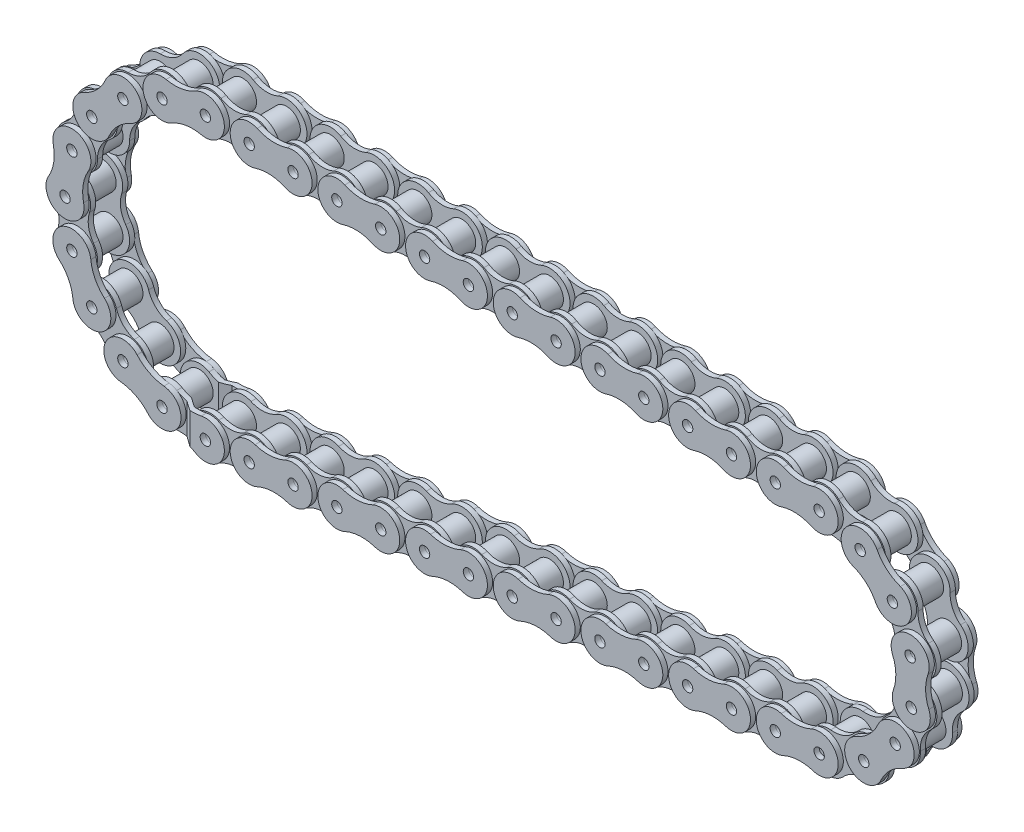
from build123d import *

# Parameters (mm, degrees)
SKETCH4_R              = 4
BOSS_EXTRUDE1_DEPTH    = 3.9
BOSS_EXTRUDE1_2_DEPTH  = 3.9
BOSS_EXTRUDE1_3_DEPTH  = 3.9
BOSS_EXTRUDE1_4_DEPTH  = 3.9
BOSS_EXTRUDE1_5_DEPTH  = 3.9
BOSS_EXTRUDE1_6_DEPTH  = 3.9
BOSS_EXTRUDE1_7_DEPTH  = 3.9
BOSS_EXTRUDE1_8_DEPTH  = 3.9
BOSS_EXTRUDE1_9_DEPTH  = 3.9
BOSS_EXTRUDE1_10_DEPTH = 3.9
BOSS_EXTRUDE1_11_DEPTH = 3.9
BOSS_EXTRUDE1_12_DEPTH = 3.9
BOSS_EXTRUDE1_13_DEPTH = 3.9
BOSS_EXTRUDE1_14_DEPTH = 3.9
BOSS_EXTRUDE1_15_DEPTH = 3.9
BOSS_EXTRUDE1_16_DEPTH = 3.9
BOSS_EXTRUDE1_17_DEPTH = 3.9
BOSS_EXTRUDE1_18_DEPTH = 3.9
BOSS_EXTRUDE1_19_DEPTH = 3.9
BOSS_EXTRUDE1_20_DEPTH = 3.9
BOSS_EXTRUDE1_21_DEPTH = 3.9
BOSS_EXTRUDE1_22_DEPTH = 3.9
BOSS_EXTRUDE1_23_DEPTH = 3.9
BOSS_EXTRUDE1_24_DEPTH = 3.9
BOSS_EXTRUDE1_25_DEPTH = 3.9
BOSS_EXTRUDE1_26_DEPTH = 3.9
BOSS_EXTRUDE1_27_DEPTH = 3.9
BOSS_EXTRUDE1_28_DEPTH = 3.9
BOSS_EXTRUDE1_29_DEPTH = 3.9
BOSS_EXTRUDE1_30_DEPTH = 3.9
BOSS_EXTRUDE1_31_DEPTH = 3.9
BOSS_EXTRUDE1_32_DEPTH = 3.9
BOSS_EXTRUDE1_33_DEPTH = 3.9
BOSS_EXTRUDE1_34_DEPTH = 3.9
BOSS_EXTRUDE1_35_DEPTH = 3.9
BOSS_EXTRUDE1_36_DEPTH = 3.9
BOSS_EXTRUDE1_37_DEPTH = 3.9
BOSS_EXTRUDE1_38_DEPTH = 3.9
BOSS_EXTRUDE1_39_DEPTH = 3.9
BOSS_EXTRUDE1_40_DEPTH = 3.9
BOSS_EXTRUDE1_41_DEPTH = 3.9
BOSS_EXTRUDE1_42_DEPTH = 3.9
BOSS_EXTRUDE1_43_DEPTH = 3.9
BOSS_EXTRUDE1_44_DEPTH = 3.9
BOSS_EXTRUDE1_45_DEPTH = 3.9
SKETCH5_R              = 1.5
BOSS_EXTRUDE2_DEPTH    = 1.5
BOSS_EXTRUDE2_2_DEPTH  = 1.5
BOSS_EXTRUDE2_3_DEPTH  = 1.5
BOSS_EXTRUDE2_4_DEPTH  = 1.5
BOSS_EXTRUDE2_5_DEPTH  = 1.5
BOSS_EXTRUDE2_6_DEPTH  = 1.5
BOSS_EXTRUDE2_7_DEPTH  = 1.5
BOSS_EXTRUDE2_8_DEPTH  = 1.5
BOSS_EXTRUDE2_9_DEPTH  = 1.5
BOSS_EXTRUDE2_10_DEPTH = 1.5
BOSS_EXTRUDE2_11_DEPTH = 1.5
BOSS_EXTRUDE2_12_DEPTH = 1.5
BOSS_EXTRUDE2_13_DEPTH = 1.5
BOSS_EXTRUDE2_14_DEPTH = 1.5
BOSS_EXTRUDE2_15_DEPTH = 1.5
BOSS_EXTRUDE2_16_DEPTH = 1.5
BOSS_EXTRUDE2_17_DEPTH = 1.5
BOSS_EXTRUDE2_18_DEPTH = 1.5
BOSS_EXTRUDE2_19_DEPTH = 1.5
BOSS_EXTRUDE2_20_DEPTH = 1.5
BOSS_EXTRUDE2_21_DEPTH = 1.5
BOSS_EXTRUDE2_22_DEPTH = 1.5
SKETCH6_R              = 1.5
BOSS_EXTRUDE3_DEPTH    = 1.5
BOSS_EXTRUDE3_2_DEPTH  = 1.5
BOSS_EXTRUDE3_3_DEPTH  = 1.5
BOSS_EXTRUDE3_4_DEPTH  = 1.5
BOSS_EXTRUDE3_5_DEPTH  = 1.5
BOSS_EXTRUDE3_6_DEPTH  = 1.5
BOSS_EXTRUDE3_7_DEPTH  = 1.5
BOSS_EXTRUDE3_8_DEPTH  = 1.5
BOSS_EXTRUDE3_9_DEPTH  = 1.5
BOSS_EXTRUDE3_10_DEPTH = 1.5
BOSS_EXTRUDE3_11_DEPTH = 1.5
BOSS_EXTRUDE3_12_DEPTH = 1.5
BOSS_EXTRUDE3_13_DEPTH = 1.5
BOSS_EXTRUDE3_14_DEPTH = 1.5
BOSS_EXTRUDE3_15_DEPTH = 1.5
BOSS_EXTRUDE3_16_DEPTH = 1.5
BOSS_EXTRUDE3_17_DEPTH = 1.5
BOSS_EXTRUDE3_18_DEPTH = 1.5
BOSS_EXTRUDE3_19_DEPTH = 1.5
BOSS_EXTRUDE3_20_DEPTH = 1.5
BOSS_EXTRUDE3_21_DEPTH = 1.5
BOSS_EXTRUDE3_22_DEPTH = 1.5
SKETCH7_R              = 1.5
BOSS_EXTRUDE4_DEPTH    = 1.5
CUT_EXTRUDE1_DEPTH     = 76


with BuildPart() as part:
    # Sketch4 → Boss-Extrude1 (new, symmetric)
    with BuildSketch(Plane.XY):
        with Locations((0, -40.59)):
            Circle(SKETCH4_R)
    extrude(amount=BOSS_EXTRUDE1_DEPTH, both=True)


with BuildPart() as body_2:
    # Sketch4 → Boss-Extrude1 2 (new, symmetric)
    with BuildSketch(Plane.XY):
        with Locations((-12.542999802, -38.603383996)):
            Circle(SKETCH4_R)
    extrude(amount=BOSS_EXTRUDE1_2_DEPTH, both=True)


with BuildPart() as body_3:
    # Sketch4 → Boss-Extrude1 3 (new, symmetric)
    with BuildSketch(Plane.XY):
        with Locations((-23.858203391, -32.837999802)):
            Circle(SKETCH4_R)
    extrude(amount=BOSS_EXTRUDE1_3_DEPTH, both=True)


with BuildPart() as body_4:
    # Sketch4 → Boss-Extrude1 4 (new, symmetric)
    with BuildSketch(Plane.XY):
        with Locations((-32.837999802, -23.858203391)):
            Circle(SKETCH4_R)
    extrude(amount=BOSS_EXTRUDE1_4_DEPTH, both=True)


with BuildPart() as body_5:
    # Sketch4 → Boss-Extrude1 5 (new, symmetric)
    with BuildSketch(Plane.XY):
        with Locations((-38.603383996, -12.542999802)):
            Circle(SKETCH4_R)
    extrude(amount=BOSS_EXTRUDE1_5_DEPTH, both=True)


with BuildPart() as body_6:
    # Sketch4 → Boss-Extrude1 6 (new, symmetric)
    with BuildSketch(Plane.XY):
        with Locations((-40.59, 0)):
            Circle(SKETCH4_R)
    extrude(amount=BOSS_EXTRUDE1_6_DEPTH, both=True)


with BuildPart() as body_7:
    # Sketch4 → Boss-Extrude1 7 (new, symmetric)
    with BuildSketch(Plane.XY):
        with Locations((-38.603383996, 12.542999802)):
            Circle(SKETCH4_R)
    extrude(amount=BOSS_EXTRUDE1_7_DEPTH, both=True)


with BuildPart() as body_8:
    # Sketch4 → Boss-Extrude1 8 (new, symmetric)
    with BuildSketch(Plane.XY):
        with Locations((-32.837999802, 23.858203391)):
            Circle(SKETCH4_R)
    extrude(amount=BOSS_EXTRUDE1_8_DEPTH, both=True)


with BuildPart() as body_9:
    # Sketch4 → Boss-Extrude1 9 (new, symmetric)
    with BuildSketch(Plane.XY):
        with Locations((-23.858203391, 32.837999802)):
            Circle(SKETCH4_R)
    extrude(amount=BOSS_EXTRUDE1_9_DEPTH, both=True)


with BuildPart() as body_10:
    # Sketch4 → Boss-Extrude1 10 (new, symmetric)
    with BuildSketch(Plane.XY):
        with Locations((-12.542999802, 38.603383996)):
            Circle(SKETCH4_R)
    extrude(amount=BOSS_EXTRUDE1_10_DEPTH, both=True)


with BuildPart() as body_11:
    # Sketch4 → Boss-Extrude1 11 (new, symmetric)
    with BuildSketch(Plane.XY):
        with Locations((0, 40.59)):
            Circle(SKETCH4_R)
    extrude(amount=BOSS_EXTRUDE1_11_DEPTH, both=True)


with BuildPart() as body_12:
    # Sketch4 → Boss-Extrude1 12 (new, symmetric)
    with BuildSketch(Plane.XY):
        with Locations((12.678180434, 39.861766629)):
            Circle(SKETCH4_R)
    extrude(amount=BOSS_EXTRUDE1_12_DEPTH, both=True)


with BuildPart() as body_13:
    # Sketch4 → Boss-Extrude1 13 (new, symmetric)
    with BuildSketch(Plane.XY):
        with Locations((25.356360868, 39.133533258)):
            Circle(SKETCH4_R)
    extrude(amount=BOSS_EXTRUDE1_13_DEPTH, both=True)


with BuildPart() as body_14:
    # Sketch4 → Boss-Extrude1 14 (new, symmetric)
    with BuildSketch(Plane.XY):
        with Locations((38.034541302, 38.405299886)):
            Circle(SKETCH4_R)
    extrude(amount=BOSS_EXTRUDE1_14_DEPTH, both=True)


with BuildPart() as body_15:
    # Sketch4 → Boss-Extrude1 15 (new, symmetric)
    with BuildSketch(Plane.XY):
        with Locations((50.712721735, 37.677066515)):
            Circle(SKETCH4_R)
    extrude(amount=BOSS_EXTRUDE1_15_DEPTH, both=True)


with BuildPart() as body_16:
    # Sketch4 → Boss-Extrude1 16 (new, symmetric)
    with BuildSketch(Plane.XY):
        with Locations((63.390902169, 36.948833144)):
            Circle(SKETCH4_R)
    extrude(amount=BOSS_EXTRUDE1_16_DEPTH, both=True)


with BuildPart() as body_17:
    # Sketch4 → Boss-Extrude1 17 (new, symmetric)
    with BuildSketch(Plane.XY):
        with Locations((76.069082603, 36.220599773)):
            Circle(SKETCH4_R)
    extrude(amount=BOSS_EXTRUDE1_17_DEPTH, both=True)


with BuildPart() as body_18:
    # Sketch4 → Boss-Extrude1 18 (new, symmetric)
    with BuildSketch(Plane.XY):
        with Locations((88.747263037, 35.492366402)):
            Circle(SKETCH4_R)
    extrude(amount=BOSS_EXTRUDE1_18_DEPTH, both=True)


with BuildPart() as body_19:
    # Sketch4 → Boss-Extrude1 19 (new, symmetric)
    with BuildSketch(Plane.XY):
        with Locations((101.425443471, 34.764133031)):
            Circle(SKETCH4_R)
    extrude(amount=BOSS_EXTRUDE1_19_DEPTH, both=True)


with BuildPart() as body_20:
    # Sketch4 → Boss-Extrude1 20 (new, symmetric)
    with BuildSketch(Plane.XY):
        with Locations((114.103623905, 34.035899659)):
            Circle(SKETCH4_R)
    extrude(amount=BOSS_EXTRUDE1_20_DEPTH, both=True)


with BuildPart() as body_21:
    # Sketch4 → Boss-Extrude1 21 (new, symmetric)
    with BuildSketch(Plane.XY):
        with Locations((126.781804338, 33.307666288)):
            Circle(SKETCH4_R)
    extrude(amount=BOSS_EXTRUDE1_21_DEPTH, both=True)


with BuildPart() as body_22:
    # Sketch4 → Boss-Extrude1 22 (new, symmetric)
    with BuildSketch(Plane.XY):
        with Locations((139.459984772, 32.579432917)):
            Circle(SKETCH4_R)
    extrude(amount=BOSS_EXTRUDE1_22_DEPTH, both=True)


with BuildPart() as body_23:
    # Sketch4 → Boss-Extrude1 23 (new, symmetric)
    with BuildSketch(Plane.XY):
        with Locations((152.138165206, 31.851199546)):
            Circle(SKETCH4_R)
    extrude(amount=BOSS_EXTRUDE1_23_DEPTH, both=True)


with BuildPart() as body_24:
    # Sketch4 → Boss-Extrude1 24 (new, symmetric)
    with BuildSketch(Plane.XY):
        with Locations((164.81634564, 31.122966175)):
            Circle(SKETCH4_R)
    extrude(amount=BOSS_EXTRUDE1_24_DEPTH, both=True)


with BuildPart() as body_25:
    # Sketch4 → Boss-Extrude1 25 (new, symmetric)
    with BuildSketch(Plane.XY):
        with Locations((177.494526074, 30.394732804)):
            Circle(SKETCH4_R)
    extrude(amount=BOSS_EXTRUDE1_25_DEPTH, both=True)


with BuildPart() as body_26:
    # Sketch4 → Boss-Extrude1 26 (new, symmetric)
    with BuildSketch(Plane.XY):
        with Locations((189.35705924, 26.502886497)):
            Circle(SKETCH4_R)
    extrude(amount=BOSS_EXTRUDE1_26_DEPTH, both=True)


with BuildPart() as body_27:
    # Sketch4 → Boss-Extrude1 27 (new, symmetric)
    with BuildSketch(Plane.XY):
        with Locations((198.673490942, 18.192034486)):
            Circle(SKETCH4_R)
    extrude(amount=BOSS_EXTRUDE1_27_DEPTH, both=True)


with BuildPart() as body_28:
    # Sketch4 → Boss-Extrude1 28 (new, symmetric)
    with BuildSketch(Plane.XY):
        with Locations((203.889136946, 6.849054386)):
            Circle(SKETCH4_R)
    extrude(amount=BOSS_EXTRUDE1_28_DEPTH, both=True)


with BuildPart() as body_29:
    # Sketch4 → Boss-Extrude1 29 (new, symmetric)
    with BuildSketch(Plane.XY):
        with Locations((204.1336337, -5.633188287)):
            Circle(SKETCH4_R)
    extrude(amount=BOSS_EXTRUDE1_29_DEPTH, both=True)


with BuildPart() as body_30:
    # Sketch4 → Boss-Extrude1 30 (new, symmetric)
    with BuildSketch(Plane.XY):
        with Locations((199.366180684, -17.171712999)):
            Circle(SKETCH4_R)
    extrude(amount=BOSS_EXTRUDE1_30_DEPTH, both=True)


with BuildPart() as body_31:
    # Sketch4 → Boss-Extrude1 31 (new, symmetric)
    with BuildSketch(Plane.XY):
        with Locations((190.382349021, -25.841022629)):
            Circle(SKETCH4_R)
    extrude(amount=BOSS_EXTRUDE1_31_DEPTH, both=True)


with BuildPart() as body_32:
    # Sketch4 → Boss-Extrude1 32 (new, symmetric)
    with BuildSketch(Plane.XY):
        with Locations(Location((164.81634564, -31.122966175, 0), (0, 0, 180))):
            Circle(SKETCH4_R)
    extrude(amount=BOSS_EXTRUDE1_32_DEPTH, both=True)


with BuildPart() as body_33:
    # Sketch4 → Boss-Extrude1 33 (new, symmetric)
    with BuildSketch(Plane.XY):
        with Locations((152.138165206, -31.851199546)):
            Circle(SKETCH4_R)
    extrude(amount=BOSS_EXTRUDE1_33_DEPTH, both=True)


with BuildPart() as body_34:
    # Sketch4 → Boss-Extrude1 34 (new, symmetric)
    with BuildSketch(Plane.XY):
        with Locations(Location((139.459984772, -32.579432917, 0), (0, 0, 180))):
            Circle(SKETCH4_R)
    extrude(amount=BOSS_EXTRUDE1_34_DEPTH, both=True)


with BuildPart() as body_35:
    # Sketch4 → Boss-Extrude1 35 (new, symmetric)
    with BuildSketch(Plane.XY):
        with Locations(Location((126.781804338, -33.307666288, 0), (0, 0, 180))):
            Circle(SKETCH4_R)
    extrude(amount=BOSS_EXTRUDE1_35_DEPTH, both=True)


with BuildPart() as body_36:
    # Sketch4 → Boss-Extrude1 36 (new, symmetric)
    with BuildSketch(Plane.XY):
        with Locations((114.103623905, -34.035899659)):
            Circle(SKETCH4_R)
    extrude(amount=BOSS_EXTRUDE1_36_DEPTH, both=True)


with BuildPart() as body_37:
    # Sketch4 → Boss-Extrude1 37 (new, symmetric)
    with BuildSketch(Plane.XY):
        with Locations((101.425443471, -34.764133031)):
            Circle(SKETCH4_R)
    extrude(amount=BOSS_EXTRUDE1_37_DEPTH, both=True)


with BuildPart() as body_38:
    # Sketch4 → Boss-Extrude1 38 (new, symmetric)
    with BuildSketch(Plane.XY):
        with Locations(Location((88.747263037, -35.492366402, 0), (0, 0, 180))):
            Circle(SKETCH4_R)
    extrude(amount=BOSS_EXTRUDE1_38_DEPTH, both=True)


with BuildPart() as body_39:
    # Sketch4 → Boss-Extrude1 39 (new, symmetric)
    with BuildSketch(Plane.XY):
        with Locations(Location((76.069082603, -36.220599773, 0), (0, 0, 180))):
            Circle(SKETCH4_R)
    extrude(amount=BOSS_EXTRUDE1_39_DEPTH, both=True)


with BuildPart() as body_40:
    # Sketch4 → Boss-Extrude1 40 (new, symmetric)
    with BuildSketch(Plane.XY):
        with Locations(Location((63.390902169, -36.948833144, 0), (0, 0, 180))):
            Circle(SKETCH4_R)
    extrude(amount=BOSS_EXTRUDE1_40_DEPTH, both=True)


with BuildPart() as body_41:
    # Sketch4 → Boss-Extrude1 41 (new, symmetric)
    with BuildSketch(Plane.XY):
        with Locations(Location((50.712721735, -37.677066515, 0), (0, 0, 180))):
            Circle(SKETCH4_R)
    extrude(amount=BOSS_EXTRUDE1_41_DEPTH, both=True)


with BuildPart() as body_42:
    # Sketch4 → Boss-Extrude1 42 (new, symmetric)
    with BuildSketch(Plane.XY):
        with Locations(Location((38.034541302, -38.405299886, 0), (0, 0, 180))):
            Circle(SKETCH4_R)
    extrude(amount=BOSS_EXTRUDE1_42_DEPTH, both=True)


with BuildPart() as body_43:
    # Sketch4 → Boss-Extrude1 43 (new, symmetric)
    with BuildSketch(Plane.XY):
        with Locations(Location((25.356360868, -39.133533258, 0), (0, 0, 180))):
            Circle(SKETCH4_R)
    extrude(amount=BOSS_EXTRUDE1_43_DEPTH, both=True)


with BuildPart() as body_44:
    # Sketch4 → Boss-Extrude1 44 (new, symmetric)
    with BuildSketch(Plane.XY):
        with Locations((12.678180434, -39.861766629)):
            Circle(SKETCH4_R)
    extrude(amount=BOSS_EXTRUDE1_44_DEPTH, both=True)


with BuildPart() as body_45:
    # Sketch4 → Boss-Extrude1 45 (new, symmetric)
    with BuildSketch(Plane.XY):
        with Locations((178.681320145, -30.194421765)):
            Circle(SKETCH4_R)
    extrude(amount=BOSS_EXTRUDE1_45_DEPTH, both=True)


with BuildPart() as body_46:
    # Sketch5 → Boss-Extrude2 (new body)
    with BuildSketch(Plane.XY.offset(3.9)):
        with BuildLine():
            ThreePointArc((2.991667607, 45.675265473), (-5.89029096, 40.928337703), (2.389718332, 35.195628276))
            ThreePointArc((2.389718332, 35.195628276), (6.088777363, 35.86806114), (9.686512826, 34.776501156))
            ThreePointArc((9.686512826, 34.776501156), (18.568471394, 39.523428926), (10.288462102, 45.256138352))
            ThreePointArc((10.288462102, 45.256138352), (6.589403071, 44.583705489), (2.991667607, 45.675265473))
        make_face()
        with Locations((0, 40.59)):
            Circle(SKETCH5_R, mode=Mode.SUBTRACT)
        with Locations((12.678180434, 39.861766629)):
            Circle(SKETCH5_R, mode=Mode.SUBTRACT)
    extrude(amount=BOSS_EXTRUDE2_DEPTH)


with BuildPart() as body_47:
    # Sketch5 → Boss-Extrude2 2 (new body)
    with BuildSketch(Plane.XY.offset(3.9)):
        with BuildLine():
            ThreePointArc((28.348028475, 44.21879873), (19.466069907, 39.47187096), (27.7460792, 33.739161534))
            ThreePointArc((27.7460792, 33.739161534), (31.44513823, 34.411594397), (35.042873694, 33.320034414))
            ThreePointArc((35.042873694, 33.320034414), (43.924832262, 38.066962184), (35.644822969, 43.79967161))
            ThreePointArc((35.644822969, 43.79967161), (31.945763939, 43.127238747), (28.348028475, 44.21879873))
        make_face()
        with Locations((25.356360868, 39.133533258)):
            Circle(SKETCH5_R, mode=Mode.SUBTRACT)
        with Locations((38.034541302, 38.405299886)):
            Circle(SKETCH5_R, mode=Mode.SUBTRACT)
    extrude(amount=BOSS_EXTRUDE2_2_DEPTH)


with BuildPart() as body_48:
    # Sketch5 → Boss-Extrude2 3 (new body)
    with BuildSketch(Plane.XY.offset(3.9)):
        with BuildLine():
            ThreePointArc((53.704389343, 42.762331988), (44.822430775, 38.015404218), (53.102440067, 32.282694792))
            ThreePointArc((53.102440067, 32.282694792), (56.801499098, 32.955127655), (60.399234562, 31.863567672))
            ThreePointArc((60.399234562, 31.863567672), (69.28119313, 36.610495441), (61.001183837, 42.343204868))
            ThreePointArc((61.001183837, 42.343204868), (57.302124807, 41.670772004), (53.704389343, 42.762331988))
        make_face()
        with Locations((50.712721735, 37.677066515)):
            Circle(SKETCH5_R, mode=Mode.SUBTRACT)
        with Locations((63.390902169, 36.948833144)):
            Circle(SKETCH5_R, mode=Mode.SUBTRACT)
    extrude(amount=BOSS_EXTRUDE2_3_DEPTH)


with BuildPart() as body_49:
    # Sketch5 → Boss-Extrude2 4 (new body)
    with BuildSketch(Plane.XY.offset(3.9)):
        with BuildLine():
            ThreePointArc((79.06075021, 41.305865246), (70.178791643, 36.558937476), (78.458800935, 30.826228049))
            ThreePointArc((78.458800935, 30.826228049), (82.157859966, 31.498660913), (85.755595429, 30.407100929))
            ThreePointArc((85.755595429, 30.407100929), (94.637553997, 35.154028699), (86.357544705, 40.886738125))
            ThreePointArc((86.357544705, 40.886738125), (82.658485674, 40.214305262), (79.06075021, 41.305865246))
        make_face()
        with Locations((76.069082603, 36.220599773)):
            Circle(SKETCH5_R, mode=Mode.SUBTRACT)
        with Locations((88.747263037, 35.492366402)):
            Circle(SKETCH5_R, mode=Mode.SUBTRACT)
    extrude(amount=BOSS_EXTRUDE2_4_DEPTH)


with BuildPart() as body_50:
    # Sketch5 → Boss-Extrude2 5 (new body)
    with BuildSketch(Plane.XY.offset(3.9)):
        with BuildLine():
            ThreePointArc((104.417111078, 39.849398503), (95.53515251, 35.102470733), (103.815161803, 29.369761307))
            ThreePointArc((103.815161803, 29.369761307), (107.514220833, 30.04219417), (111.111956297, 28.950634187))
            ThreePointArc((111.111956297, 28.950634187), (119.993914865, 33.697561957), (111.713905572, 39.430271383))
            ThreePointArc((111.713905572, 39.430271383), (108.014846542, 38.75783852), (104.417111078, 39.849398503))
        make_face()
        with Locations((101.425443471, 34.764133031)):
            Circle(SKETCH5_R, mode=Mode.SUBTRACT)
        with Locations((114.103623905, 34.035899659)):
            Circle(SKETCH5_R, mode=Mode.SUBTRACT)
    extrude(amount=BOSS_EXTRUDE2_5_DEPTH)


with BuildPart() as body_51:
    # Sketch5 → Boss-Extrude2 6 (new body)
    with BuildSketch(Plane.XY.offset(3.9)):
        with BuildLine():
            ThreePointArc((129.773471946, 38.392931761), (120.891513378, 33.646003991), (129.17152267, 27.913294565))
            ThreePointArc((129.17152267, 27.913294565), (132.870581701, 28.585727428), (136.468317165, 27.494167445))
            ThreePointArc((136.468317165, 27.494167445), (145.350275733, 32.241095214), (137.07026644, 37.973804641))
            ThreePointArc((137.07026644, 37.973804641), (133.37120741, 37.301371777), (129.773471946, 38.392931761))
        make_face()
        with Locations((126.781804338, 33.307666288)):
            Circle(SKETCH5_R, mode=Mode.SUBTRACT)
        with Locations((139.459984772, 32.579432917)):
            Circle(SKETCH5_R, mode=Mode.SUBTRACT)
    extrude(amount=BOSS_EXTRUDE2_6_DEPTH)


with BuildPart() as body_52:
    # Sketch5 → Boss-Extrude2 7 (new body)
    with BuildSketch(Plane.XY.offset(3.9)):
        with BuildLine():
            ThreePointArc((155.129832813, 36.936465019), (146.247874246, 32.189537249), (154.527883538, 26.456827822))
            ThreePointArc((154.527883538, 26.456827822), (158.226942569, 27.129260686), (161.824678032, 26.037700702))
            ThreePointArc((161.824678032, 26.037700702), (170.7066366, 30.784628472), (162.426627308, 36.517337898))
            ThreePointArc((162.426627308, 36.517337898), (158.727568277, 35.844905035), (155.129832813, 36.936465019))
        make_face()
        with Locations((152.138165206, 31.851199546)):
            Circle(SKETCH5_R, mode=Mode.SUBTRACT)
        with Locations((164.81634564, 31.122966175)):
            Circle(SKETCH5_R, mode=Mode.SUBTRACT)
    extrude(amount=BOSS_EXTRUDE2_7_DEPTH)


with BuildPart() as body_53:
    # Sketch5 → Boss-Extrude2 8 (new body)
    with BuildSketch(Plane.XY.offset(3.9)):
        with BuildLine():
            ThreePointArc((154.527883538, -26.456827822), (158.226942569, -27.129260686), (161.824678032, -26.037700702))
            ThreePointArc((161.824678032, -26.037700702), (170.7066366, -30.784628472), (162.426627308, -36.517337898))
            ThreePointArc((162.426627308, -36.517337898), (158.727568277, -35.844905035), (155.129832813, -36.936465019))
            ThreePointArc((155.129832813, -36.936465019), (146.247874246, -32.189537249), (154.527883538, -26.456827822))
        make_face()
        with Locations(Location((164.81634564, -31.122966175, 0), (0, 0, 180))):
            Circle(SKETCH5_R, mode=Mode.SUBTRACT)
        with Locations(Location((152.138165206, -31.851199546, 0), (0, 0, 180))):
            Circle(SKETCH5_R, mode=Mode.SUBTRACT)
    extrude(amount=BOSS_EXTRUDE2_8_DEPTH)


with BuildPart() as body_54:
    # Sketch5 → Boss-Extrude2 9 (new body)
    with BuildSketch(Plane.XY.offset(3.9)):
        with BuildLine():
            ThreePointArc((129.17152267, -27.913294565), (132.870581701, -28.585727428), (136.468317165, -27.494167445))
            ThreePointArc((136.468317165, -27.494167445), (145.350275733, -32.241095214), (137.07026644, -37.973804641))
            ThreePointArc((137.07026644, -37.973804641), (133.37120741, -37.301371777), (129.773471946, -38.392931761))
            ThreePointArc((129.773471946, -38.392931761), (120.891513378, -33.646003991), (129.17152267, -27.913294565))
        make_face()
        with Locations(Location((139.459984772, -32.579432917, 0), (0, 0, 180))):
            Circle(SKETCH5_R, mode=Mode.SUBTRACT)
        with Locations(Location((126.781804338, -33.307666288, 0), (0, 0, 180))):
            Circle(SKETCH5_R, mode=Mode.SUBTRACT)
    extrude(amount=BOSS_EXTRUDE2_9_DEPTH)


with BuildPart() as body_55:
    # Sketch5 → Boss-Extrude2 10 (new body)
    with BuildSketch(Plane.XY.offset(3.9)):
        with BuildLine():
            ThreePointArc((103.815161803, -29.369761307), (107.514220833, -30.04219417), (111.111956297, -28.950634187))
            ThreePointArc((111.111956297, -28.950634187), (119.993914865, -33.697561957), (111.713905572, -39.430271383))
            ThreePointArc((111.713905572, -39.430271383), (108.014846542, -38.75783852), (104.417111078, -39.849398503))
            ThreePointArc((104.417111078, -39.849398503), (95.53515251, -35.102470733), (103.815161803, -29.369761307))
        make_face()
        with Locations(Location((114.103623905, -34.035899659, 0), (0, 0, 180))):
            Circle(SKETCH5_R, mode=Mode.SUBTRACT)
        with Locations(Location((101.425443471, -34.764133031, 0), (0, 0, 180))):
            Circle(SKETCH5_R, mode=Mode.SUBTRACT)
    extrude(amount=BOSS_EXTRUDE2_10_DEPTH)


with BuildPart() as body_56:
    # Sketch5 → Boss-Extrude2 11 (new body)
    with BuildSketch(Plane.XY.offset(3.9)):
        with BuildLine():
            ThreePointArc((78.458800935, -30.826228049), (82.157859966, -31.498660913), (85.755595429, -30.407100929))
            ThreePointArc((85.755595429, -30.407100929), (94.637553997, -35.154028699), (86.357544705, -40.886738125))
            ThreePointArc((86.357544705, -40.886738125), (82.658485674, -40.214305262), (79.06075021, -41.305865246))
            ThreePointArc((79.06075021, -41.305865246), (70.178791643, -36.558937476), (78.458800935, -30.826228049))
        make_face()
        with Locations(Location((88.747263037, -35.492366402, 0), (0, 0, 180))):
            Circle(SKETCH5_R, mode=Mode.SUBTRACT)
        with Locations(Location((76.069082603, -36.220599773, 0), (0, 0, 180))):
            Circle(SKETCH5_R, mode=Mode.SUBTRACT)
    extrude(amount=BOSS_EXTRUDE2_11_DEPTH)


with BuildPart() as body_57:
    # Sketch5 → Boss-Extrude2 12 (new body)
    with BuildSketch(Plane.XY.offset(3.9)):
        with BuildLine():
            ThreePointArc((53.102440067, -32.282694792), (56.801499098, -32.955127655), (60.399234562, -31.863567672))
            ThreePointArc((60.399234562, -31.863567672), (69.28119313, -36.610495441), (61.001183837, -42.343204868))
            ThreePointArc((61.001183837, -42.343204868), (57.302124807, -41.670772004), (53.704389343, -42.762331988))
            ThreePointArc((53.704389343, -42.762331988), (44.822430775, -38.015404218), (53.102440067, -32.282694792))
        make_face()
        with Locations(Location((63.390902169, -36.948833144, 0), (0, 0, 180))):
            Circle(SKETCH5_R, mode=Mode.SUBTRACT)
        with Locations(Location((50.712721735, -37.677066515, 0), (0, 0, 180))):
            Circle(SKETCH5_R, mode=Mode.SUBTRACT)
    extrude(amount=BOSS_EXTRUDE2_12_DEPTH)


with BuildPart() as body_58:
    # Sketch5 → Boss-Extrude2 13 (new body)
    with BuildSketch(Plane.XY.offset(3.9)):
        with BuildLine():
            ThreePointArc((27.7460792, -33.739161534), (31.44513823, -34.411594397), (35.042873694, -33.320034414))
            ThreePointArc((35.042873694, -33.320034414), (43.924832262, -38.066962184), (35.644822969, -43.79967161))
            ThreePointArc((35.644822969, -43.79967161), (31.945763939, -43.127238747), (28.348028475, -44.21879873))
            ThreePointArc((28.348028475, -44.21879873), (19.466069907, -39.47187096), (27.7460792, -33.739161534))
        make_face()
        with Locations(Location((38.034541302, -38.405299886, 0), (0, 0, 180))):
            Circle(SKETCH5_R, mode=Mode.SUBTRACT)
        with Locations(Location((25.356360868, -39.133533258, 0), (0, 0, 180))):
            Circle(SKETCH5_R, mode=Mode.SUBTRACT)
    extrude(amount=BOSS_EXTRUDE2_13_DEPTH)


with BuildPart() as body_59:
    # Sketch5 → Boss-Extrude2 14 (new body)
    with BuildSketch(Plane.XY.offset(3.9)):
        with BuildLine():
            ThreePointArc((2.389718332, -35.195628276), (6.088777363, -35.86806114), (9.686512826, -34.776501156))
            ThreePointArc((9.686512826, -34.776501156), (18.568471394, -39.523428926), (10.288462102, -45.256138352))
            ThreePointArc((10.288462102, -45.256138352), (6.589403071, -44.583705489), (2.991667607, -45.675265473))
            ThreePointArc((2.991667607, -45.675265473), (-5.89029096, -40.928337703), (2.389718332, -35.195628276))
        make_face()
        with Locations(Location((12.678180434, -39.861766629, 0), (0, 0, 180))):
            Circle(SKETCH5_R, mode=Mode.SUBTRACT)
        with Locations(Location((0, -40.59, 0), (0, 0, 180))):
            Circle(SKETCH5_R, mode=Mode.SUBTRACT)
    extrude(amount=BOSS_EXTRUDE2_14_DEPTH)


with BuildPart() as body_60:
    # Sketch5 → Boss-Extrude2 15 (new body)
    with BuildSketch(Plane.XY.offset(3.9)):
        with BuildLine():
            ThreePointArc((181.655427281, 34.577662535), (171.88852041, 32.233944727), (178.368800815, 24.559868308))
            ThreePointArc((178.368800815, 24.559868308), (182.048104766, 24.249551249), (185.196158033, 22.319956765))
            ThreePointArc((185.196158033, 22.319956765), (194.963064904, 24.663674574), (188.482784499, 32.337750992))
            ThreePointArc((188.482784499, 32.337750992), (184.803480548, 32.648068052), (181.655427281, 34.577662535))
        make_face()
        with Locations((177.494526074, 30.394732804)):
            Circle(SKETCH5_R, mode=Mode.SUBTRACT)
        with Locations((189.35705924, 26.502886497)):
            Circle(SKETCH5_R, mode=Mode.SUBTRACT)
    extrude(amount=BOSS_EXTRUDE2_15_DEPTH)


with BuildPart() as body_61:
    # Sketch5 → Boss-Extrude2 16 (new body)
    with BuildSketch(Plane.XY.offset(3.9)):
        with BuildLine():
            ThreePointArc((204.569926969, 17.986992608), (196.20867667, 23.552509335), (194.990890268, 13.582430134))
            ThreePointArc((194.990890268, 13.582430134), (197.265973897, 10.674240194), (197.992700919, 7.054096263))
            ThreePointArc((197.992700919, 7.054096263), (206.353951217, 1.488579536), (207.571737619, 11.458658737))
            ThreePointArc((207.571737619, 11.458658737), (205.296653991, 14.366848677), (204.569926969, 17.986992608))
        make_face()
        with Locations((198.673490942, 18.192034486)):
            Circle(SKETCH5_R, mode=Mode.SUBTRACT)
        with Locations((203.889136946, 6.849054386)):
            Circle(SKETCH5_R, mode=Mode.SUBTRACT)
    extrude(amount=BOSS_EXTRUDE2_16_DEPTH)


with BuildPart() as body_62:
    # Sketch5 → Boss-Extrude2 17 (new body)
    with BuildSketch(Plane.XY.offset(3.9)):
        with BuildLine():
            ThreePointArc((207.993922232, -10.095045798), (206.386640561, -0.180302805), (198.249750002, -6.068977956))
            ThreePointArc((198.249750002, -6.068977956), (197.665345643, -9.714803759), (195.505892151, -12.709855488))
            ThreePointArc((195.505892151, -12.709855488), (197.113173823, -22.624598482), (205.250064381, -16.73592333))
            ThreePointArc((205.250064381, -16.73592333), (205.83446874, -13.090097527), (207.993922232, -10.095045798))
        make_face()
        with Locations((204.1336337, -5.633188287)):
            Circle(SKETCH5_R, mode=Mode.SUBTRACT)
        with Locations((199.366180684, -17.171712999)):
            Circle(SKETCH5_R, mode=Mode.SUBTRACT)
    extrude(amount=BOSS_EXTRUDE2_17_DEPTH)


with BuildPart() as body_63:
    # Sketch5 → Boss-Extrude2 18 (new body)
    with BuildSketch(Plane.XY.offset(3.9)):
        with BuildLine():
            ThreePointArc((189.737238815, -31.705648177), (195.912030854, -23.783689691), (186.060835459, -21.824242757))
            ThreePointArc((186.060835459, -21.824242757), (182.990760038, -23.875635248), (179.326430351, -24.329796217))
            ThreePointArc((179.326430351, -24.329796217), (173.151638311, -32.251754703), (183.002833706, -34.211201637))
            ThreePointArc((183.002833706, -34.211201637), (186.072909127, -32.159809146), (189.737238815, -31.705648177))
        make_face()
        with Locations((190.382349021, -25.841022629)):
            Circle(SKETCH5_R, mode=Mode.SUBTRACT)
        with Locations((178.681320145, -30.194421765)):
            Circle(SKETCH5_R, mode=Mode.SUBTRACT)
    extrude(amount=BOSS_EXTRUDE2_18_DEPTH)


with BuildPart() as body_64:
    # Sketch5 → Boss-Extrude2 19 (new body)
    with BuildSketch(Plane.XY.offset(3.9)):
        with BuildLine():
            ThreePointArc((-12.561692436, 32.703413608), (-7.286061309, 41.281927945), (-17.327163367, 42.056176921))
            ThreePointArc((-17.327163367, 42.056176921), (-20.182240814, 39.609877846), (-23.839510756, 38.73797019))
            ThreePointArc((-23.839510756, 38.73797019), (-29.115141883, 30.159455853), (-19.074039825, 29.385206877))
            ThreePointArc((-19.074039825, 29.385206877), (-16.218962379, 31.831505953), (-12.561692436, 32.703413608))
        make_face()
        with Locations((-12.542999802, 38.603383996)):
            Circle(SKETCH5_R, mode=Mode.SUBTRACT)
        with Locations((-23.858203391, 32.837999802)):
            Circle(SKETCH5_R, mode=Mode.SUBTRACT)
    extrude(amount=BOSS_EXTRUDE2_19_DEPTH)


with BuildPart() as body_65:
    # Sketch5 → Boss-Extrude2 20 (new body)
    with BuildSketch(Plane.XY.offset(3.9)):
        with BuildLine():
            ThreePointArc((-29.385206877, 19.074039825), (-30.159455853, 29.115141883), (-38.73797019, 23.839510756))
            ThreePointArc((-38.73797019, 23.839510756), (-39.609877846, 20.182240814), (-42.056176921, 17.327163367))
            ThreePointArc((-42.056176921, 17.327163367), (-41.281927945, 7.286061309), (-32.703413608, 12.561692436))
            ThreePointArc((-32.703413608, 12.561692436), (-31.831505953, 16.218962379), (-29.385206877, 19.074039825))
        make_face()
        with Locations((-32.837999802, 23.858203391)):
            Circle(SKETCH5_R, mode=Mode.SUBTRACT)
        with Locations((-38.603383996, 12.542999802)):
            Circle(SKETCH5_R, mode=Mode.SUBTRACT)
    extrude(amount=BOSS_EXTRUDE2_20_DEPTH)


with BuildPart() as body_66:
    # Sketch5 → Boss-Extrude2 21 (new body)
    with BuildSketch(Plane.XY.offset(3.9)):
        with BuildLine():
            ThreePointArc((-34.984571058, -1.840968868), (-41.512963344, 5.82736121), (-45.352189056, -3.483038242))
            ThreePointArc((-45.352189056, -3.483038242), (-43.907887831, -6.95432624), (-44.208812939, -10.702030934))
            ThreePointArc((-44.208812939, -10.702030934), (-37.680420653, -18.370361011), (-33.841194941, -9.05996156))
            ThreePointArc((-33.841194941, -9.05996156), (-35.285496166, -5.588673562), (-34.984571058, -1.840968868))
        make_face()
        with Locations((-40.59, 0)):
            Circle(SKETCH5_R, mode=Mode.SUBTRACT)
        with Locations((-38.603383996, -12.542999802)):
            Circle(SKETCH5_R, mode=Mode.SUBTRACT)
    extrude(amount=BOSS_EXTRUDE2_21_DEPTH)


with BuildPart() as body_67:
    # Sketch5 → Boss-Extrude2 22 (new body)
    with BuildSketch(Plane.XY.offset(3.9)):
        with BuildLine():
            ThreePointArc((-27.221018176, -22.052790026), (-37.009929811, -19.686273382), (-34.643413166, -29.475185016))
            ThreePointArc((-34.643413166, -29.475185016), (-31.434577039, -31.434577039), (-29.475185016, -34.643413166))
            ThreePointArc((-29.475185016, -34.643413166), (-19.686273382, -37.009929811), (-22.052790026, -27.221018176))
            ThreePointArc((-22.052790026, -27.221018176), (-25.261626154, -25.261626154), (-27.221018176, -22.052790026))
        make_face()
        with Locations((-32.837999802, -23.858203391)):
            Circle(SKETCH5_R, mode=Mode.SUBTRACT)
        with Locations((-23.858203391, -32.837999802)):
            Circle(SKETCH5_R, mode=Mode.SUBTRACT)
    extrude(amount=BOSS_EXTRUDE2_22_DEPTH)


with BuildPart() as body_68:
    # Sketch6 → Boss-Extrude3 (new body)
    with BuildSketch(Plane.XY.offset(5.4)):
        with BuildLine():
            ThreePointArc((-11.373712717, 43.977653036), (-17.975285675, 37.742994439), (-9.770201235, 33.853479986))
            ThreePointArc((-9.770201235, 33.853479986), (-5.597672487, 35.342313142), (-1.169287085, 35.21573096))
            ThreePointArc((-1.169287085, 35.21573096), (5.432285873, 41.450389558), (-2.772798567, 45.33990401))
            ThreePointArc((-2.772798567, 45.33990401), (-6.945327315, 43.851070854), (-11.373712717, 43.977653036))
        make_face()
        with Locations((0, 40.59)):
            Circle(SKETCH6_R, mode=Mode.SUBTRACT)
        with Locations((-12.542999802, 38.603383996)):
            Circle(SKETCH6_R, mode=Mode.SUBTRACT)
    extrude(amount=BOSS_EXTRUDE3_DEPTH)


with BuildPart() as body_69:
    # Sketch6 → Boss-Extrude3 2 (new body)
    with BuildSketch(Plane.XY.offset(5.4)):
        with BuildLine():
            ThreePointArc((14.964372593, 44.864098626), (7.187231233, 40.177166182), (14.376559268, 34.630561286))
            ThreePointArc((14.376559268, 34.630561286), (18.770257568, 35.197275158), (23.070168708, 34.13120126))
            ThreePointArc((23.070168708, 34.13120126), (30.847310068, 38.818133704), (23.657982033, 44.3647386))
            ThreePointArc((23.657982033, 44.3647386), (19.264283733, 43.798024728), (14.964372593, 44.864098626))
        make_face()
        with Locations((25.356360868, 39.133533258)):
            Circle(SKETCH6_R, mode=Mode.SUBTRACT)
        with Locations((12.678180434, 39.861766629)):
            Circle(SKETCH6_R, mode=Mode.SUBTRACT)
    extrude(amount=BOSS_EXTRUDE3_2_DEPTH)


with BuildPart() as body_70:
    # Sketch6 → Boss-Extrude3 3 (new body)
    with BuildSketch(Plane.XY.offset(5.4)):
        with BuildLine():
            ThreePointArc((40.320733461, 43.407631884), (32.543592101, 38.72069944), (39.732920136, 33.174094544))
            ThreePointArc((39.732920136, 33.174094544), (44.126618436, 33.740808416), (48.426529576, 32.674734518))
            ThreePointArc((48.426529576, 32.674734518), (56.203670936, 37.361666962), (49.014342901, 42.908271858))
            ThreePointArc((49.014342901, 42.908271858), (44.620644601, 42.341557986), (40.320733461, 43.407631884))
        make_face()
        with Locations((50.712721735, 37.677066515)):
            Circle(SKETCH6_R, mode=Mode.SUBTRACT)
        with Locations((38.034541302, 38.405299886)):
            Circle(SKETCH6_R, mode=Mode.SUBTRACT)
    extrude(amount=BOSS_EXTRUDE3_3_DEPTH)


with BuildPart() as body_71:
    # Sketch6 → Boss-Extrude3 4 (new body)
    with BuildSketch(Plane.XY.offset(5.4)):
        with BuildLine():
            ThreePointArc((65.677094328, 41.951165141), (57.899952969, 37.264232698), (65.089281003, 31.717627802))
            ThreePointArc((65.089281003, 31.717627802), (69.482979304, 32.284341673), (73.782890444, 31.218267776))
            ThreePointArc((73.782890444, 31.218267776), (81.560031803, 35.90520022), (74.370703769, 41.451805115))
            ThreePointArc((74.370703769, 41.451805115), (69.977005468, 40.885091244), (65.677094328, 41.951165141))
        make_face()
        with Locations((76.069082603, 36.220599773)):
            Circle(SKETCH6_R, mode=Mode.SUBTRACT)
        with Locations((63.390902169, 36.948833144)):
            Circle(SKETCH6_R, mode=Mode.SUBTRACT)
    extrude(amount=BOSS_EXTRUDE3_4_DEPTH)


with BuildPart() as body_72:
    # Sketch6 → Boss-Extrude3 5 (new body)
    with BuildSketch(Plane.XY.offset(5.4)):
        with BuildLine():
            ThreePointArc((91.033455196, 40.494698399), (83.256313836, 35.807765955), (90.445641871, 30.261161059))
            ThreePointArc((90.445641871, 30.261161059), (94.839340171, 30.827874931), (99.139251311, 29.761801033))
            ThreePointArc((99.139251311, 29.761801033), (106.916392671, 34.448733477), (99.727064636, 39.995338373))
            ThreePointArc((99.727064636, 39.995338373), (95.333366336, 39.428624501), (91.033455196, 40.494698399))
        make_face()
        with Locations((101.425443471, 34.764133031)):
            Circle(SKETCH6_R, mode=Mode.SUBTRACT)
        with Locations((88.747263037, 35.492366402)):
            Circle(SKETCH6_R, mode=Mode.SUBTRACT)
    extrude(amount=BOSS_EXTRUDE3_5_DEPTH)


with BuildPart() as body_73:
    # Sketch6 → Boss-Extrude3 6 (new body)
    with BuildSketch(Plane.XY.offset(5.4)):
        with BuildLine():
            ThreePointArc((116.389816064, 39.038231657), (108.612674704, 34.351299213), (115.802002739, 28.804694317))
            ThreePointArc((115.802002739, 28.804694317), (120.195701039, 29.371408189), (124.495612179, 28.305334291))
            ThreePointArc((124.495612179, 28.305334291), (132.272753539, 32.992266735), (125.083425504, 38.538871631))
            ThreePointArc((125.083425504, 38.538871631), (120.689727204, 37.972157759), (116.389816064, 39.038231657))
        make_face()
        with Locations((126.781804338, 33.307666288)):
            Circle(SKETCH6_R, mode=Mode.SUBTRACT)
        with Locations((114.103623905, 34.035899659)):
            Circle(SKETCH6_R, mode=Mode.SUBTRACT)
    extrude(amount=BOSS_EXTRUDE3_6_DEPTH)


with BuildPart() as body_74:
    # Sketch6 → Boss-Extrude3 7 (new body)
    with BuildSketch(Plane.XY.offset(5.4)):
        with BuildLine():
            ThreePointArc((141.746176931, 37.581764914), (133.969035572, 32.894832471), (141.158363606, 27.348227575))
            ThreePointArc((141.158363606, 27.348227575), (145.552061907, 27.914941446), (149.851973047, 26.848867549))
            ThreePointArc((149.851973047, 26.848867549), (157.629114406, 31.535799992), (150.439786372, 37.082404888))
            ThreePointArc((150.439786372, 37.082404888), (146.046088071, 36.515691017), (141.746176931, 37.581764914))
        make_face()
        with Locations((152.138165206, 31.851199546)):
            Circle(SKETCH6_R, mode=Mode.SUBTRACT)
        with Locations((139.459984772, 32.579432917)):
            Circle(SKETCH6_R, mode=Mode.SUBTRACT)
    extrude(amount=BOSS_EXTRUDE3_7_DEPTH)


with BuildPart() as body_75:
    # Sketch6 → Boss-Extrude3 8 (new body)
    with BuildSketch(Plane.XY.offset(5.4)):
        with BuildLine():
            ThreePointArc((167.102537799, 36.125298172), (159.325396439, 31.438365728), (166.514724474, 25.891760832))
            ThreePointArc((166.514724474, 25.891760832), (170.908422774, 26.458474704), (175.208333914, 25.392400806))
            ThreePointArc((175.208333914, 25.392400806), (182.985475274, 30.07933325), (175.796147239, 35.625938146))
            ThreePointArc((175.796147239, 35.625938146), (171.402448939, 35.059224274), (167.102537799, 36.125298172))
        make_face()
        with Locations((177.494526074, 30.394732804)):
            Circle(SKETCH6_R, mode=Mode.SUBTRACT)
        with Locations((164.81634564, 31.122966175)):
            Circle(SKETCH6_R, mode=Mode.SUBTRACT)
    extrude(amount=BOSS_EXTRUDE3_8_DEPTH)


with BuildPart() as body_76:
    # Sketch6 → Boss-Extrude3 9 (new body)
    with BuildSketch(Plane.XY.offset(5.4)):
        with BuildLine():
            ThreePointArc((175.208333914, -25.392400806), (170.908422774, -26.458474704), (166.514724474, -25.891760832))
            ThreePointArc((166.514724474, -25.891760832), (159.325396439, -31.438365728), (167.102537799, -36.125298172))
            ThreePointArc((167.102537799, -36.125298172), (171.402448939, -35.059224274), (175.796147239, -35.625938146))
            ThreePointArc((175.796147239, -35.625938146), (182.985475274, -30.07933325), (175.208333914, -25.392400806))
        make_face()
        with Locations(Location((164.81634564, -31.122966175, 0), (0, 0, 180))):
            Circle(SKETCH6_R, mode=Mode.SUBTRACT)
        with Locations(Location((177.494526074, -30.394732804, 0), (0, 0, 180))):
            Circle(SKETCH6_R, mode=Mode.SUBTRACT)
    extrude(amount=BOSS_EXTRUDE3_9_DEPTH)


with BuildPart() as body_77:
    # Sketch6 → Boss-Extrude3 10 (new body)
    with BuildSketch(Plane.XY.offset(5.4)):
        with BuildLine():
            ThreePointArc((149.851973047, -26.848867549), (145.552061907, -27.914941446), (141.158363606, -27.348227575))
            ThreePointArc((141.158363606, -27.348227575), (133.969035572, -32.894832471), (141.746176931, -37.581764914))
            ThreePointArc((141.746176931, -37.581764914), (146.046088071, -36.515691017), (150.439786372, -37.082404888))
            ThreePointArc((150.439786372, -37.082404888), (157.629114406, -31.535799992), (149.851973047, -26.848867549))
        make_face()
        with Locations(Location((139.459984772, -32.579432917, 0), (0, 0, 180))):
            Circle(SKETCH6_R, mode=Mode.SUBTRACT)
        with Locations(Location((152.138165206, -31.851199546, 0), (0, 0, 180))):
            Circle(SKETCH6_R, mode=Mode.SUBTRACT)
    extrude(amount=BOSS_EXTRUDE3_10_DEPTH)


with BuildPart() as body_78:
    # Sketch6 → Boss-Extrude3 11 (new body)
    with BuildSketch(Plane.XY.offset(5.4)):
        with BuildLine():
            ThreePointArc((124.495612179, -28.305334291), (120.195701039, -29.371408189), (115.802002739, -28.804694317))
            ThreePointArc((115.802002739, -28.804694317), (108.612674704, -34.351299213), (116.389816064, -39.038231657))
            ThreePointArc((116.389816064, -39.038231657), (120.689727204, -37.972157759), (125.083425504, -38.538871631))
            ThreePointArc((125.083425504, -38.538871631), (132.272753539, -32.992266735), (124.495612179, -28.305334291))
        make_face()
        with Locations(Location((114.103623905, -34.035899659, 0), (0, 0, 180))):
            Circle(SKETCH6_R, mode=Mode.SUBTRACT)
        with Locations(Location((126.781804338, -33.307666288, 0), (0, 0, 180))):
            Circle(SKETCH6_R, mode=Mode.SUBTRACT)
    extrude(amount=BOSS_EXTRUDE3_11_DEPTH)


with BuildPart() as body_79:
    # Sketch6 → Boss-Extrude3 12 (new body)
    with BuildSketch(Plane.XY.offset(5.4)):
        with BuildLine():
            ThreePointArc((99.139251311, -29.761801033), (94.839340171, -30.827874931), (90.445641871, -30.261161059))
            ThreePointArc((90.445641871, -30.261161059), (83.256313836, -35.807765955), (91.033455196, -40.494698399))
            ThreePointArc((91.033455196, -40.494698399), (95.333366336, -39.428624501), (99.727064636, -39.995338373))
            ThreePointArc((99.727064636, -39.995338373), (106.916392671, -34.448733477), (99.139251311, -29.761801033))
        make_face()
        with Locations(Location((88.747263037, -35.492366402, 0), (0, 0, 180))):
            Circle(SKETCH6_R, mode=Mode.SUBTRACT)
        with Locations(Location((101.425443471, -34.764133031, 0), (0, 0, 180))):
            Circle(SKETCH6_R, mode=Mode.SUBTRACT)
    extrude(amount=BOSS_EXTRUDE3_12_DEPTH)


with BuildPart() as body_80:
    # Sketch6 → Boss-Extrude3 13 (new body)
    with BuildSketch(Plane.XY.offset(5.4)):
        with BuildLine():
            ThreePointArc((73.782890444, -31.218267776), (69.482979304, -32.284341673), (65.089281003, -31.717627802))
            ThreePointArc((65.089281003, -31.717627802), (57.899952969, -37.264232698), (65.677094328, -41.951165141))
            ThreePointArc((65.677094328, -41.951165141), (69.977005468, -40.885091244), (74.370703769, -41.451805115))
            ThreePointArc((74.370703769, -41.451805115), (81.560031803, -35.90520022), (73.782890444, -31.218267776))
        make_face()
        with Locations(Location((63.390902169, -36.948833144, 0), (0, 0, 180))):
            Circle(SKETCH6_R, mode=Mode.SUBTRACT)
        with Locations(Location((76.069082603, -36.220599773, 0), (0, 0, 180))):
            Circle(SKETCH6_R, mode=Mode.SUBTRACT)
    extrude(amount=BOSS_EXTRUDE3_13_DEPTH)


with BuildPart() as body_81:
    # Sketch6 → Boss-Extrude3 14 (new body)
    with BuildSketch(Plane.XY.offset(5.4)):
        with BuildLine():
            ThreePointArc((48.426529576, -32.674734518), (44.126618436, -33.740808416), (39.732920136, -33.174094544))
            ThreePointArc((39.732920136, -33.174094544), (32.543592101, -38.72069944), (40.320733461, -43.407631884))
            ThreePointArc((40.320733461, -43.407631884), (44.620644601, -42.341557986), (49.014342901, -42.908271858))
            ThreePointArc((49.014342901, -42.908271858), (56.203670936, -37.361666962), (48.426529576, -32.674734518))
        make_face()
        with Locations(Location((38.034541302, -38.405299886, 0), (0, 0, 180))):
            Circle(SKETCH6_R, mode=Mode.SUBTRACT)
        with Locations(Location((50.712721735, -37.677066515, 0), (0, 0, 180))):
            Circle(SKETCH6_R, mode=Mode.SUBTRACT)
    extrude(amount=BOSS_EXTRUDE3_14_DEPTH)


with BuildPart() as body_82:
    # Sketch6 → Boss-Extrude3 15 (new body)
    with BuildSketch(Plane.XY.offset(5.4)):
        with BuildLine():
            ThreePointArc((23.070168708, -34.13120126), (18.770257568, -35.197275158), (14.376559268, -34.630561286))
            ThreePointArc((14.376559268, -34.630561286), (7.187231233, -40.177166182), (14.964372593, -44.864098626))
            ThreePointArc((14.964372593, -44.864098626), (19.264283733, -43.798024728), (23.657982033, -44.3647386))
            ThreePointArc((23.657982033, -44.3647386), (30.847310068, -38.818133704), (23.070168708, -34.13120126))
        make_face()
        with Locations(Location((12.678180434, -39.861766629, 0), (0, 0, 180))):
            Circle(SKETCH6_R, mode=Mode.SUBTRACT)
        with Locations(Location((25.356360868, -39.133533258, 0), (0, 0, 180))):
            Circle(SKETCH6_R, mode=Mode.SUBTRACT)
    extrude(amount=BOSS_EXTRUDE3_15_DEPTH)


with BuildPart() as body_83:
    # Sketch6 → Boss-Extrude3 16 (new body)
    with BuildSketch(Plane.XY.offset(5.4)):
        with BuildLine():
            ThreePointArc((194.245999129, 29.022463199), (185.380069315, 30.302037867), (187.063617725, 21.503873993))
            ThreePointArc((187.063617725, 21.503873993), (191.104588877, 19.137470309), (193.932151751, 15.404615846))
            ThreePointArc((193.932151751, 15.404615846), (202.741749393, 14.490781567), (201.001565618, 23.175012341))
            ThreePointArc((201.001565618, 23.175012341), (197.059267404, 25.446552997), (194.245999129, 29.022463199))
        make_face()
        with Locations((198.673490942, 18.192034486)):
            Circle(SKETCH6_R, mode=Mode.SUBTRACT)
        with Locations((189.35705924, 26.502886497)):
            Circle(SKETCH6_R, mode=Mode.SUBTRACT)
    extrude(amount=BOSS_EXTRUDE3_16_DEPTH)


with BuildPart() as body_84:
    # Sketch6 → Boss-Extrude3 17 (new body)
    with BuildSketch(Plane.XY.offset(5.4)):
        with BuildLine():
            ThreePointArc((201.627115671, -22.047867911), (203.42341883, -13.14705006), (194.477392768, -14.702646785))
            ThreePointArc((194.477392768, -14.702646785), (191.927809868, -18.32554292), (188.237469894, -20.776489725))
            ThreePointArc((188.237469894, -20.776489725), (186.441166736, -29.677307577), (195.387192798, -28.121710852))
            ThreePointArc((195.387192798, -28.121710852), (197.936775698, -24.498814717), (201.627115671, -22.047867911))
        make_face()
        with Locations((190.382349021, -25.841022629)):
            Circle(SKETCH6_R, mode=Mode.SUBTRACT)
        with Locations((199.482236545, -16.983335007)):
            Circle(SKETCH6_R, mode=Mode.SUBTRACT)
    extrude(amount=BOSS_EXTRUDE3_17_DEPTH)


with BuildPart() as body_85:
    # Sketch6 → Boss-Extrude3 18 (new body)
    with BuildSketch(Plane.XY.offset(5.4)):
        with BuildLine():
            ThreePointArc((208.986378018, 5.196570359), (203.673165009, 12.560063482), (198.739254185, 4.937217069))
            ThreePointArc((198.739254185, 4.937217069), (199.666895041, 0.605331589), (198.959580366, -3.767934389))
            ThreePointArc((198.959580366, -3.767934389), (204.272793376, -11.131427513), (209.2067042, -3.5085811))
            ThreePointArc((209.2067042, -3.5085811), (208.279063344, 0.82330438), (208.986378018, 5.196570359))
        make_face()
        with Locations((204.1336337, -5.633188287)):
            Circle(SKETCH6_R, mode=Mode.SUBTRACT)
        with Locations((203.812324685, 7.061824256)):
            Circle(SKETCH6_R, mode=Mode.SUBTRACT)
    extrude(amount=BOSS_EXTRUDE3_18_DEPTH)


with BuildPart() as body_86:
    # Sketch6 → Boss-Extrude3 19 (new body)
    with BuildSketch(Plane.XY.offset(5.4)):
        with BuildLine():
            ThreePointArc((-35.050942762, 28.89336808), (-36.727087098, 19.969116094), (-27.802835112, 21.64526043))
            ThreePointArc((-27.802835112, 21.64526043), (-25.302302618, 25.302302618), (-21.64526043, 27.802835112))
            ThreePointArc((-21.64526043, 27.802835112), (-19.969116094, 36.727087098), (-28.89336808, 35.050942762))
            ThreePointArc((-28.89336808, 35.050942762), (-31.393900575, 31.393900575), (-35.050942762, 28.89336808))
        make_face()
        with Locations((-23.858203391, 32.837999802)):
            Circle(SKETCH6_R, mode=Mode.SUBTRACT)
        with Locations((-32.837999802, 23.858203391)):
            Circle(SKETCH6_R, mode=Mode.SUBTRACT)
    extrude(amount=BOSS_EXTRUDE3_19_DEPTH)


with BuildPart() as body_87:
    # Sketch6 → Boss-Extrude3 20 (new body)
    with BuildSketch(Plane.XY.offset(5.4)):
        with BuildLine():
            ThreePointArc((-45.33990401, 2.772798567), (-41.450389558, -5.432285873), (-35.21573096, 1.169287085))
            ThreePointArc((-35.21573096, 1.169287085), (-35.342313142, 5.597672487), (-33.853479986, 9.770201235))
            ThreePointArc((-33.853479986, 9.770201235), (-37.742994439, 17.975285675), (-43.977653036, 11.373712717))
            ThreePointArc((-43.977653036, 11.373712717), (-43.851070854, 6.945327315), (-45.33990401, 2.772798567))
        make_face()
        with Locations((-38.603383996, 12.542999802)):
            Circle(SKETCH6_R, mode=Mode.SUBTRACT)
        with Locations((-40.59, 0)):
            Circle(SKETCH6_R, mode=Mode.SUBTRACT)
    extrude(amount=BOSS_EXTRUDE3_20_DEPTH)


with BuildPart() as body_88:
    # Sketch6 → Boss-Extrude3 21 (new body)
    with BuildSketch(Plane.XY.offset(5.4)):
        with BuildLine():
            ThreePointArc((-38.310562973, -24.406885755), (-30.341052053, -28.758739274), (-29.17741452, -19.753314184))
            ThreePointArc((-29.17741452, -19.753314184), (-31.882761287, -16.245078276), (-33.130820825, -11.994317437))
            ThreePointArc((-33.130820825, -11.994317437), (-41.100331745, -7.642463919), (-42.263969278, -16.647889008))
            ThreePointArc((-42.263969278, -16.647889008), (-39.558622511, -20.156124916), (-38.310562973, -24.406885755))
        make_face()
        with Locations((-38.603383996, -12.542999802)):
            Circle(SKETCH6_R, mode=Mode.SUBTRACT)
        with Locations((-32.837999802, -23.858203391)):
            Circle(SKETCH6_R, mode=Mode.SUBTRACT)
    extrude(amount=BOSS_EXTRUDE3_21_DEPTH)


with BuildPart() as body_89:
    # Sketch6 → Boss-Extrude3 22 (new body)
    with BuildSketch(Plane.XY.offset(5.4)):
        with BuildLine():
            ThreePointArc((-16.647889008, -42.263969278), (-7.642463919, -41.100331745), (-11.994317437, -33.130820825))
            ThreePointArc((-11.994317437, -33.130820825), (-16.245078276, -31.882761287), (-19.753314184, -29.17741452))
            ThreePointArc((-19.753314184, -29.17741452), (-28.758739274, -30.341052053), (-24.406885755, -38.310562973))
            ThreePointArc((-24.406885755, -38.310562973), (-20.156124916, -39.558622511), (-16.647889008, -42.263969278))
        make_face()
        with Locations((-23.858203391, -32.837999802)):
            Circle(SKETCH6_R, mode=Mode.SUBTRACT)
        with Locations((-12.542999802, -38.603383996)):
            Circle(SKETCH6_R, mode=Mode.SUBTRACT)
    extrude(amount=BOSS_EXTRUDE3_22_DEPTH)


with BuildPart() as body_90:
    # Mirror2: mirrored copy
    add(body_69.part.mirror(Plane.XY))


with BuildPart() as body_91:
    # Mirror2 2: mirrored copy
    add(body_68.part.mirror(Plane.XY))


with BuildPart() as body_92:
    # Mirror2 3: mirrored copy
    add(body_70.part.mirror(Plane.XY))


with BuildPart() as body_93:
    # Mirror2 4: mirrored copy
    add(body_71.part.mirror(Plane.XY))


with BuildPart() as body_94:
    # Mirror2 5: mirrored copy
    add(body_72.part.mirror(Plane.XY))


with BuildPart() as body_95:
    # Mirror2 6: mirrored copy
    add(body_73.part.mirror(Plane.XY))


with BuildPart() as body_96:
    # Mirror2 7: mirrored copy
    add(body_74.part.mirror(Plane.XY))


with BuildPart() as body_97:
    # Mirror2 8: mirrored copy
    add(body_75.part.mirror(Plane.XY))


with BuildPart() as body_98:
    # Mirror2 9: mirrored copy
    add(body_83.part.mirror(Plane.XY))


with BuildPart() as body_99:
    # Mirror2 10: mirrored copy
    add(body_85.part.mirror(Plane.XY))


with BuildPart() as body_100:
    # Mirror2 11: mirrored copy
    add(body_84.part.mirror(Plane.XY))


with BuildPart() as body_101:
    # Mirror2 12: mirrored copy
    add(body_76.part.mirror(Plane.XY))


with BuildPart() as body_102:
    # Mirror2 13: mirrored copy
    add(body_77.part.mirror(Plane.XY))


with BuildPart() as body_103:
    # Mirror2 14: mirrored copy
    add(body_78.part.mirror(Plane.XY))


with BuildPart() as body_104:
    # Mirror2 15: mirrored copy
    add(body_79.part.mirror(Plane.XY))


with BuildPart() as body_105:
    # Mirror2 16: mirrored copy
    add(body_80.part.mirror(Plane.XY))


with BuildPart() as body_106:
    # Mirror2 17: mirrored copy
    add(body_81.part.mirror(Plane.XY))


with BuildPart() as body_107:
    # Mirror2 18: mirrored copy
    add(body_82.part.mirror(Plane.XY))


with BuildPart() as body_108:
    # Mirror2 19: mirrored copy
    add(body_59.part.mirror(Plane.XY))


with BuildPart() as body_109:
    # Mirror2 20: mirrored copy
    add(body_89.part.mirror(Plane.XY))


with BuildPart() as body_110:
    # Mirror2 21: mirrored copy
    add(body_88.part.mirror(Plane.XY))


with BuildPart() as body_111:
    # Mirror2 22: mirrored copy
    add(body_87.part.mirror(Plane.XY))


with BuildPart() as body_112:
    # Mirror2 23: mirrored copy
    add(body_86.part.mirror(Plane.XY))


with BuildPart() as body_113:
    # Mirror2 24: mirrored copy
    add(body_52.part.mirror(Plane.XY))


with BuildPart() as body_114:
    # Mirror2 25: mirrored copy
    add(body_51.part.mirror(Plane.XY))


with BuildPart() as body_115:
    # Mirror2 26: mirrored copy
    add(body_50.part.mirror(Plane.XY))


with BuildPart() as body_116:
    # Mirror2 27: mirrored copy
    add(body_49.part.mirror(Plane.XY))


with BuildPart() as body_117:
    # Mirror2 28: mirrored copy
    add(body_48.part.mirror(Plane.XY))


with BuildPart() as body_118:
    # Mirror2 29: mirrored copy
    add(body_47.part.mirror(Plane.XY))


with BuildPart() as body_119:
    # Mirror2 30: mirrored copy
    add(body_46.part.mirror(Plane.XY))


with BuildPart() as body_120:
    # Mirror2 31: mirrored copy
    add(body_64.part.mirror(Plane.XY))


with BuildPart() as body_121:
    # Mirror2 32: mirrored copy
    add(body_65.part.mirror(Plane.XY))


with BuildPart() as body_122:
    # Mirror2 33: mirrored copy
    add(body_66.part.mirror(Plane.XY))


with BuildPart() as body_123:
    # Mirror2 34: mirrored copy
    add(body_67.part.mirror(Plane.XY))


with BuildPart() as body_124:
    # Mirror2 35: mirrored copy
    add(body_58.part.mirror(Plane.XY))


with BuildPart() as body_125:
    # Mirror2 36: mirrored copy
    add(body_57.part.mirror(Plane.XY))


with BuildPart() as body_126:
    # Mirror2 37: mirrored copy
    add(body_56.part.mirror(Plane.XY))


with BuildPart() as body_127:
    # Mirror2 38: mirrored copy
    add(body_55.part.mirror(Plane.XY))


with BuildPart() as body_128:
    # Mirror2 39: mirrored copy
    add(body_60.part.mirror(Plane.XY))


with BuildPart() as body_129:
    # Mirror2 40: mirrored copy
    add(body_61.part.mirror(Plane.XY))


with BuildPart() as body_130:
    # Mirror2 41: mirrored copy
    add(body_62.part.mirror(Plane.XY))


with BuildPart() as body_131:
    # Mirror2 42: mirrored copy
    add(body_63.part.mirror(Plane.XY))


with BuildPart() as body_132:
    # Mirror2 43: mirrored copy
    add(body_53.part.mirror(Plane.XY))


with BuildPart() as body_133:
    # Mirror2 44: mirrored copy
    add(body_54.part.mirror(Plane.XY))


with BuildPart() as body_134:
    # Sketch7 → Boss-Extrude4 (new, symmetric)
    with BuildSketch(Plane(origin=(0, 0, -5.4), x_dir=(-1, 0, 0), z_dir=(0, 0, -1))):
        with BuildLine():
            ThreePointArc((1.169287085, -35.21573096), (-5.432285873, -41.450389558), (2.772798567, -45.33990401))
            ThreePointArc((2.772798567, -45.33990401), (6.945327315, -43.851070854), (11.373712717, -43.977653036))
            ThreePointArc((11.373712717, -43.977653036), (17.975285675, -37.742994439), (9.770201235, -33.853479986))
            ThreePointArc((9.770201235, -33.853479986), (5.597672487, -35.342313142), (1.169287085, -35.21573096))
        make_face()
        with Locations((0, -40.59)):
            Circle(SKETCH7_R, mode=Mode.SUBTRACT)
        with Locations((12.542999802, -38.603383996)):
            Circle(SKETCH7_R, mode=Mode.SUBTRACT)
    extrude(amount=BOSS_EXTRUDE4_DEPTH, both=True)


with BuildPart() as body_135:
    # Mirror3: mirrored copy
    add(body_134.part.mirror(Plane.XY))


with BuildPart() as cut_extrude1_tool:
    # Sketch8 → Cut-Extrude1 (new body)
    with BuildSketch(Plane(origin=(0, 0, 0), x_dir=(1, 0, 0), z_dir=(0, 1, 0))):
        Polygon((6.640064855, -5.4), (-4.666111559, -5.4), (-8.870098033, -2.687232264), (6.640064855, -2.687232264), align=None)
        Polygon((-4.479974253, -6.9), (-6.804529955, -5.4), (-20.145113707, -5.4), (-20.145113707, -8.320059737), (-4.479974253, -8.320059737), align=None)
        Polygon((-4.479974253, 8.320059737), (-4.479974253, 6.9), (-6.804529955, 5.4), (-20.145113707, 5.4), (-20.145113707, 8.320059737), align=None)
        Polygon((6.640064855, 2.687232264), (6.640064855, 5.4), (-4.666111559, 5.4), (-8.870098033, 2.687232264), align=None)
    extrude(amount=-CUT_EXTRUDE1_DEPTH)


with BuildPart() as body_135_1:
    add(body_135.part)

    # Cut-Extrude1: cut by cut_extrude1_tool
    add(cut_extrude1_tool.part, mode=Mode.SUBTRACT)


with BuildPart() as body_134_1:
    add(body_134.part)

    # Cut-Extrude1: cut by cut_extrude1_tool
    add(cut_extrude1_tool.part, mode=Mode.SUBTRACT)


solid = Compound([part.part, body_2.part, body_3.part, body_4.part, body_5.part, body_6.part, body_7.part, body_8.part, body_9.part, body_10.part, body_11.part, body_12.part, body_13.part, body_14.part, body_15.part, body_16.part, body_17.part, body_18.part, body_19.part, body_20.part, body_21.part, body_22.part, body_23.part, body_24.part, body_25.part, body_26.part, body_27.part, body_28.part, body_29.part, body_30.part, body_31.part, body_32.part, body_33.part, body_34.part, body_35.part, body_36.part, body_37.part, body_38.part, body_39.part, body_40.part, body_41.part, body_42.part, body_43.part, body_44.part, body_45.part, body_46.part, body_47.part, body_48.part, body_49.part, body_50.part, body_51.part, body_52.part, body_53.part, body_54.part, body_55.part, body_56.part, body_57.part, body_58.part, body_59.part, body_60.part, body_61.part, body_62.part, body_63.part, body_64.part, body_65.part, body_66.part, body_67.part, body_68.part, body_69.part, body_70.part, body_71.part, body_72.part, body_73.part, body_74.part, body_75.part, body_76.part, body_77.part, body_78.part, body_79.part, body_80.part, body_81.part, body_82.part, body_83.part, body_84.part, body_85.part, body_86.part, body_87.part, body_88.part, body_89.part, body_90.part, body_91.part, body_92.part, body_93.part, body_94.part, body_95.part, body_96.part, body_97.part, body_98.part, body_99.part, body_100.part, body_101.part, body_102.part, body_103.part, body_104.part, body_105.part, body_106.part, body_107.part, body_108.part, body_109.part, body_110.part, body_111.part, body_112.part, body_113.part, body_114.part, body_115.part, body_116.part, body_117.part, body_118.part, body_119.part, body_120.part, body_121.part, body_122.part, body_123.part, body_124.part, body_125.part, body_126.part, body_127.part, body_128.part, body_129.part, body_130.part, body_131.part, body_132.part, body_133.part, body_135_1.part, body_134_1.part])
